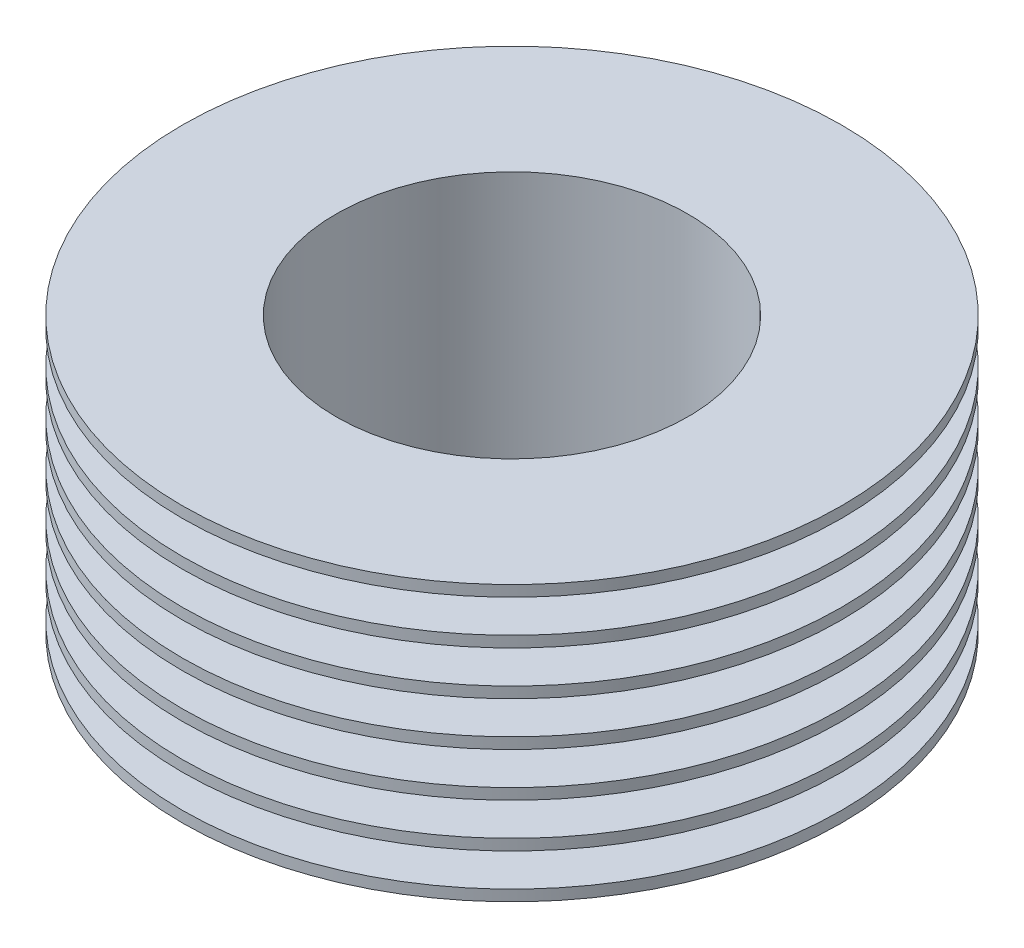
from build123d import *

# Parameters (mm, degrees)
LPATTERN1_COUNT    = 7
LPATTERN1_PITCH    = 4
SKETCH3_R          = 19.047367533
CUT_EXTRUDE3_DEPTH = 5


with BuildPart() as part:
    # Sketch1 → Revolve1 (revolve)
    with BuildSketch(Plane(origin=(0, 0, 0), x_dir=(0, 0, -1), z_dir=(1, 0, 0))):
        Polygon((-18, 14.838658872), (-18, 9.838658872), (-30, 9.838658872), (-30, 8.838658872), (-16, 8.838658872), (-16, 14.838658872), align=None)
    revolve1 = revolve(axis=Axis((0, 28.058626224, 0), (0, -1, 0)))

    # LPattern1: Revolve1 ×7
    with Locations(*[(0, i * LPATTERN1_PITCH, 0) for i in range(1, LPATTERN1_COUNT)]):
        add(revolve1)

    # Sketch3 → Cut-Extrude3 (cut)
    with BuildSketch(Plane(origin=(0, 38.838658872, 0), x_dir=(1, 0, 0), z_dir=(0, 1, 0))):
        Circle(SKETCH3_R)
    extrude(amount=-CUT_EXTRUDE3_DEPTH, mode=Mode.SUBTRACT)


solid = part.part
